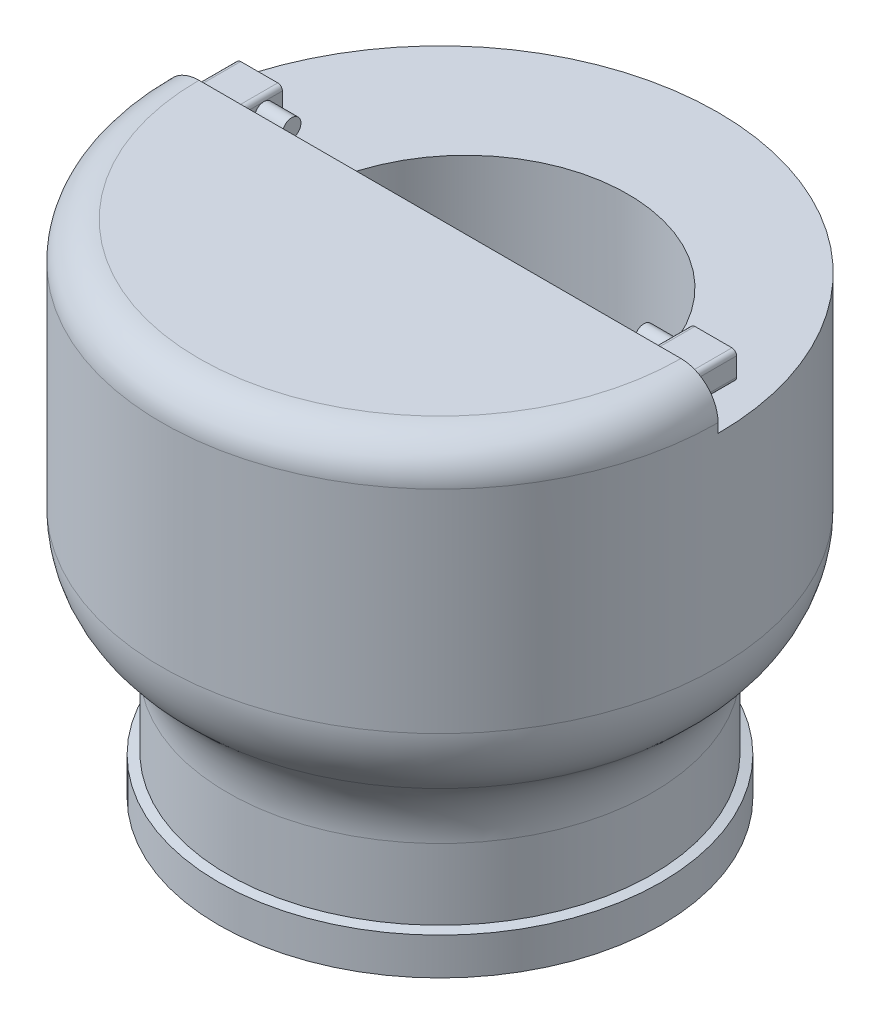
from build123d import *

# Parameters (mm, degrees)
SKETCH10_R              = 10
BOSS_EXTRUDE1_DEPTH     = 5
CUT_EXTRUDE3_DEPTH      = 45
CUT_EXTRUDE3_DEPTH_BACK = 20
CUT_EXTRUDE5_DEPTH      = 5
BOSS_EXTRUDE2_DEPTH     = 5
SKETCH14_R              = 1
BOSS_EXTRUDE3_DEPTH     = 3
SKETCH15_R              = 1
BOSS_EXTRUDE4_DEPTH     = 3


with BuildPart() as part:
    # Sketch1 → Revolve1 (revolve)
    with BuildSketch(Plane.XY):
        with BuildLine():
            Line((20.9, 0), (23.871591838, 0))
            Line((23.871591838, 0), (23.871591838, 4))
            Line((23.871591838, 4), (22.9, 4.236662843))
            Line((22.9, 4.236662843), (22.9, 11.874576818))
            ThreePointArc((22.9, 11.874576818), (23.83692213, 16.100759435), (26.472123903, 19.535021249))
            Line((26.472123903, 19.535021249), (26.427876097, 19.497892931))
            ThreePointArc((26.427876097, 19.497892931), (29.06307787, 22.932154745), (30, 27.158337362))
            Line((30, 27.158337362), (30, 50))
            ThreePointArc((30, 50), (28.828427125, 52.828427125), (26, 54))
            Line((26, 54), (0, 54))
            Line((0, 54), (0, 15))
            Line((0, 15), (19.9, 15))
            ThreePointArc((19.9, 15), (20.607106781, 14.707106781), (20.9, 14))
            Line((20.9, 14), (20.9, 0))
        make_face()
    revolve(axis=Axis((0, 0, 0), (0, 1, 0)))

    # Sketch10 → Boss-Extrude1 (add)
    with BuildSketch(Plane(origin=(0, 0, -30), x_dir=(-1, 0, 0), z_dir=(0, 0, -1))):
        with Locations((3.346345887, 38.658337362)):
            Circle(SKETCH10_R)
    extrude(amount=-BOSS_EXTRUDE1_DEPTH)

    # Sketch11 → Cut-Extrude3 (cut, two sides: drawn at the far end of the back side and taken through both)
    with BuildSketch(Plane(origin=(0, 17, 0), x_dir=(1, 0, 0), z_dir=(0, 1, 0)).offset(-CUT_EXTRUDE3_DEPTH_BACK)):
        with BuildLine():
            Line((-14.735085045, 0), (20.264914955, 0))
            ThreePointArc((20.264914955, 0), (2.764914955, 17.5), (-14.735085045, 0))
        make_face()
    extrude(amount=CUT_EXTRUDE3_DEPTH + CUT_EXTRUDE3_DEPTH_BACK, mode=Mode.SUBTRACT)

    # Sketch9 → Cut-Extrude5 (cut)
    with BuildSketch(Plane(origin=(0, 54, 0), x_dir=(1, 0, 0), z_dir=(0, 1, 0))):
        with BuildLine():
            Line((-30, 0), (30, 0))
            ThreePointArc((30, 0), (0, 30), (-30, 0))
        make_face()
    extrude(amount=-CUT_EXTRUDE5_DEPTH, mode=Mode.SUBTRACT)

    # Sketch13 → Boss-Extrude2 (add)
    with BuildSketch(Plane(origin=(0, 0, 0), x_dir=(-1, 0, 0), z_dir=(0, 0, -1))):
        with BuildLine():
            Line((22.5, 53), (26.5, 53))
            ThreePointArc((26.5, 53), (26.853553391, 52.853553391), (27, 52.5))
            Line((27, 52.5), (27, 50.5))
            ThreePointArc((27, 50.5), (26.853553391, 50.146446609), (26.5, 50))
            Line((26.5, 50), (22.5, 50))
            ThreePointArc((22.5, 50), (22.146446609, 50.146446609), (22, 50.5))
            Line((22, 50.5), (22, 52.5))
            ThreePointArc((22, 52.5), (22.146446609, 52.853553391), (22.5, 53))
        make_face()
        with BuildLine():
            Line((-26.5, 52.75), (-22.5, 52.75))
            ThreePointArc((-22.5, 52.75), (-22.146446609, 52.603553391), (-22, 52.25))
            Line((-22, 52.25), (-22, 50.25))
            ThreePointArc((-22, 50.25), (-22.146446609, 49.896446609), (-22.5, 49.75))
            Line((-22.5, 49.75), (-26.5, 49.75))
            ThreePointArc((-26.5, 49.75), (-26.853553391, 49.896446609), (-27, 50.25))
            Line((-27, 50.25), (-27, 52.25))
            ThreePointArc((-27, 52.25), (-26.853553391, 52.603553391), (-26.5, 52.75))
        make_face()
    extrude(amount=BOSS_EXTRUDE2_DEPTH)

    # Sketch14 → Boss-Extrude3 (add)
    with BuildSketch(Plane.ZY.offset(-22)):
        with Locations((-3, 51.25)):
            Circle(SKETCH14_R)
    extrude(amount=BOSS_EXTRUDE3_DEPTH)

    # Sketch15 → Boss-Extrude4 (add)
    with BuildSketch(Plane(origin=(-22, 0, 0), x_dir=(0, 0, -1), z_dir=(1, 0, 0))):
        with Locations((3, 51.5)):
            Circle(SKETCH15_R)
    extrude(amount=BOSS_EXTRUDE4_DEPTH)


solid = part.part
